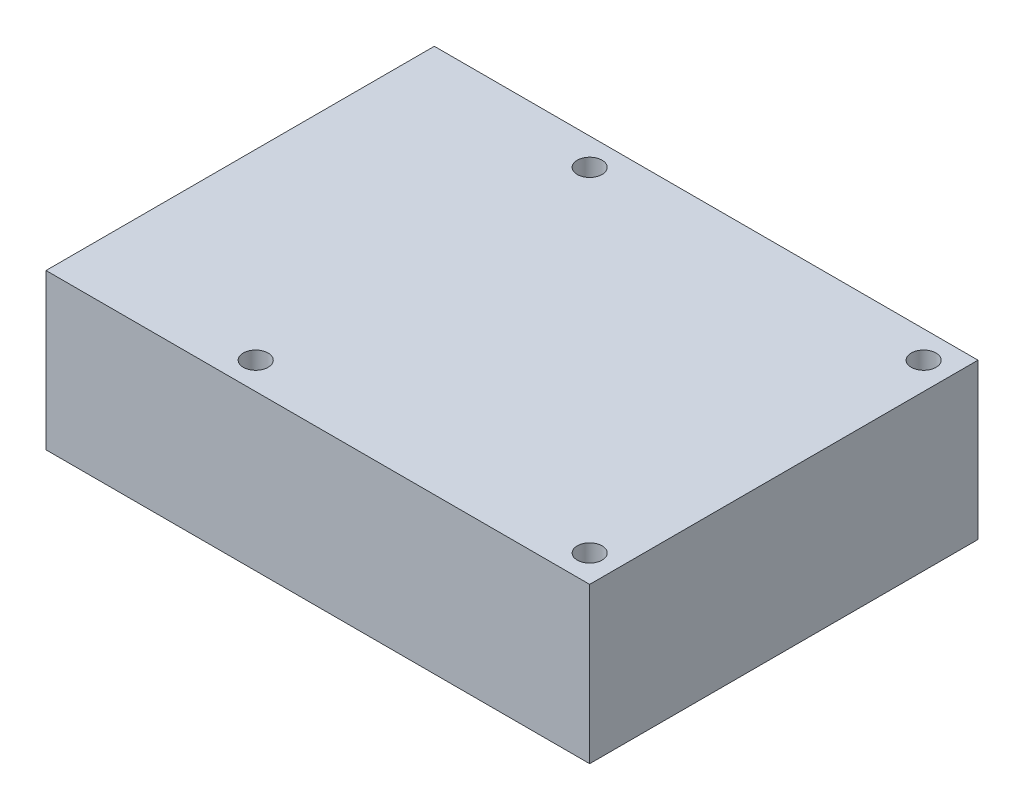
from build123d import *

# Parameters (mm, degrees)
SKETCH1_W           = 50
SKETCH1_H           = 50
SKETCH1_R           = 1.6
BOSS_EXTRUDE1_DEPTH = 20
CUT_EXTRUDE1_START  = -5
CUT_EXTRUDE1_DEPTH  = 2.3
SKETCH3_W           = 50
SKETCH3_H           = 20
BOSS_EXTRUDE2_DEPTH = 20


with BuildPart() as part:
    # Sketch1 → Boss-Extrude1 (new body)
    with BuildSketch(Plane(origin=(0, 0, 0), x_dir=(1, 0, 0), z_dir=(0, 1, 0))):
        Rectangle(SKETCH1_W, SKETCH1_H)
        with Locations(Location((21.5, 21.5, 0), (0, 0, 270))):
            Circle(SKETCH1_R, mode=Mode.SUBTRACT)
        with Locations(Location((21.5, -21.5, 0), (0, 0, 270))):
            Circle(SKETCH1_R, mode=Mode.SUBTRACT)
        with Locations(Location((-21.5, -21.5, 0), (0, 0, 270))):
            Circle(SKETCH1_R, mode=Mode.SUBTRACT)
        with Locations(Location((-21.5, 21.5, 0), (0, 0, 270))):
            Circle(SKETCH1_R, mode=Mode.SUBTRACT)
    extrude(amount=BOSS_EXTRUDE1_DEPTH)

    # Sketch2 → Cut-Extrude1 (cut)
    with BuildSketch(Plane(origin=(0, 20, 0), x_dir=(1, 0, 0), z_dir=(0, 1, 0)).offset(CUT_EXTRUDE1_START)):
        Polygon((24.675426481, 21.5), (23.08771324, 24.25), (19.91228676, 24.25), (18.324573519, 21.5), (19.91228676, 18.75), (23.08771324, 18.75), align=None)
        Polygon((-21.5, 24.675426481), (-24.25, 23.08771324), (-24.25, 19.91228676), (-21.5, 18.324573519), (-18.75, 19.91228676), (-18.75, 23.08771324), align=None)
        Polygon((21.5, -24.675426481), (24.25, -23.08771324), (24.25, -19.91228676), (21.5, -18.324573519), (18.75, -19.91228676), (18.75, -23.08771324), align=None)
        Polygon((-24.675426481, -21.5), (-23.08771324, -24.25), (-19.91228676, -24.25), (-18.324573519, -21.5), (-19.91228676, -18.75), (-23.08771324, -18.75), align=None)
    extrude(amount=-CUT_EXTRUDE1_DEPTH, mode=Mode.SUBTRACT)

    # Sketch3 → Boss-Extrude2 (add)
    with BuildSketch(Plane.ZY.offset(25)):
        with Locations((0, 10)):
            Rectangle(SKETCH3_W, SKETCH3_H)
    extrude(amount=BOSS_EXTRUDE2_DEPTH)


solid = part.part
